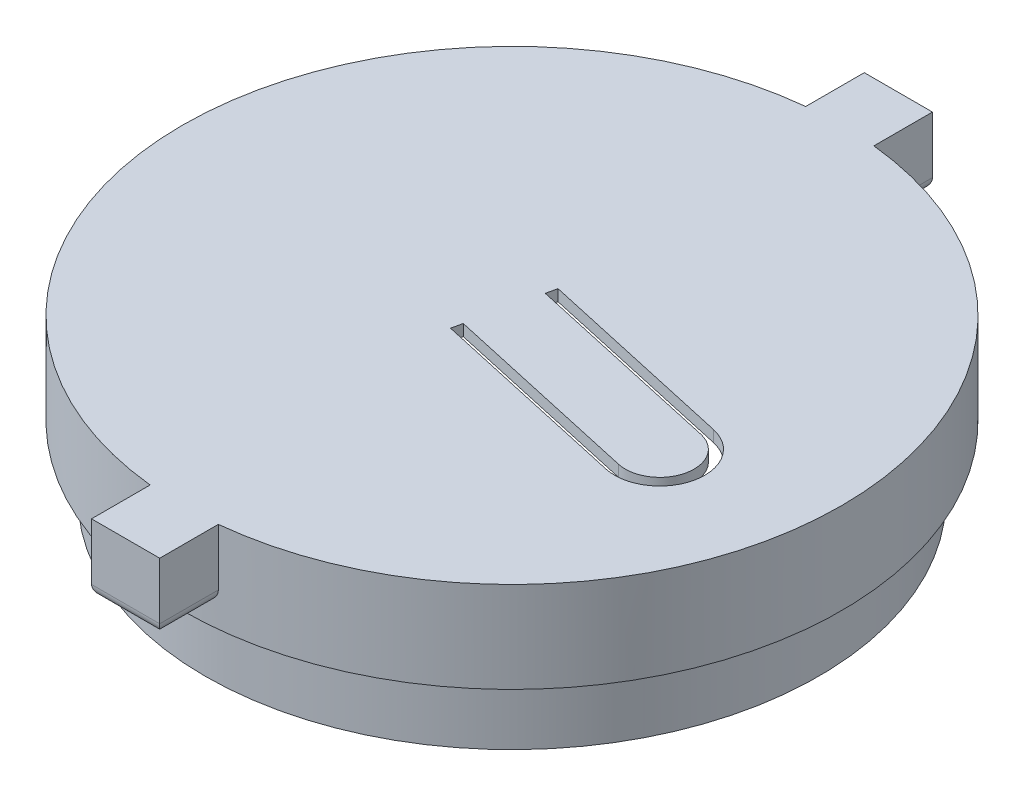
from build123d import *
from build123d.topology import SkipClean

# Parameters (mm, degrees)
SKETCH7_R            = 14.5
SKETCH7_R_2          = 12.5
BOSS_EXTRUDE2_DEPTH  = 4
BOSS_EXTRUDE6_START  = 3.5
SKETCH7_3_R          = 14.5
BOSS_EXTRUDE6_DEPTH  = 0.5
BOSS_EXTRUDE10_START = 4.3
BOSS_EXTRUDE10_DEPTH = 4.3
BOSS_EXTRUDE9_START  = -3
BOSS_EXTRUDE9_DEPTH  = 3
FILLET6_R            = 0.5
CUT_EXTRUDE1_DEPTH   = 58.251550322
SKETCH16_R           = 1
BOSS_EXTRUDE11_DEPTH = 1
FILLET7_R            = 0.5
EXTRUDE_THIN2_START  = 3
SKETCH17_R           = 13.5
SKETCH17_R_2         = 12.5
EXTRUDE_THIN2_DEPTH  = 3


with BuildPart() as part:
    # Sketch7 → Boss-Extrude2 (new body)
    with BuildSketch(Plane(origin=(0, 0, 0), x_dir=(1, 0, 0), z_dir=(0, 1, 0))):
        with Locations((40, 0)):
            Circle(SKETCH7_R)
        with Locations((40, 0)):
            Circle(SKETCH7_R_2, mode=Mode.SUBTRACT)
    extrude(amount=BOSS_EXTRUDE2_DEPTH)

    # Sketch7<3> → Boss-Extrude6 (add)
    with BuildSketch(Plane(origin=(0, 0, 0), x_dir=(1, 0, 0), z_dir=(0, 1, 0)).offset(BOSS_EXTRUDE6_START)):
        with Locations((40, 0)):
            Circle(SKETCH7_3_R)
    extrude(amount=BOSS_EXTRUDE6_DEPTH)

    # Sketch14 → Boss-Extrude10 (add)
    with BuildSketch(Plane.XZ.offset(-3.5).offset(BOSS_EXTRUDE10_START)):
        with BuildLine():
            Line((48.005623024, -9.6), (31.994376976, -9.6))
            ThreePointArc((31.994376976, -9.6), (40, -12.5), (48.005623024, -9.6))
        make_face()
        with BuildLine():
            Line((50.85, -6.207052441), (50.85, 6.207052441))
            ThreePointArc((50.85, 6.207052441), (52.5, 0), (50.85, -6.207052441))
        make_face()
        with BuildLine():
            Line((48.005623024, 9.6), (31.994376976, 9.6))
            ThreePointArc((31.994376976, 9.6), (40, 12.5), (48.005623024, 9.6))
        make_face()
        with BuildLine():
            Line((29.15, -6.207052441), (29.15, 6.207052441))
            ThreePointArc((29.15, 6.207052441), (27.5, 0), (29.15, -6.207052441))
        make_face()
    extrude(amount=-BOSS_EXTRUDE10_DEPTH)

    # Sketch11 → Boss-Extrude9 (add)
    with BuildSketch(Plane(origin=(0, 4, 0), x_dir=(1, 0, 0), z_dir=(0, 1, 0)).offset(BOSS_EXTRUDE9_START)):
        with BuildLine():
            Line((41.5, 17), (38.5, 17))
            Line((38.5, 17), (38.5, 14.422205102))
            ThreePointArc((38.5, 14.422205102), (40, 14.5), (41.5, 14.422205102))
            Line((41.5, 14.422205102), (41.5, 17))
        make_face()
        with BuildLine():
            ThreePointArc((41.5, -14.422205102), (40, -14.5), (38.5, -14.422205102))
            Line((38.5, -14.422205102), (38.5, -17))
            Line((38.5, -17), (41.5, -17))
            Line((41.5, -17), (41.5, -14.422205102))
        make_face()
    extrude(amount=BOSS_EXTRUDE9_DEPTH)

    # Fillet6
    fillet6_edges = [part.edges().sort_by_distance(p)[0] for p in [
        (41.5, 1, 15.711102551),
        (38.5, 1, 15.711102551),
        (38.5, 1, -15.711102551),
        (41.5, 1, -15.711102551),
        (40, 1, -17),
        (40, 1, 17),
    ]]
    fillet(fillet6_edges, radius=FILLET6_R)

    # Sketch15 → Cut-Extrude1 (cut, through all)
    with BuildSketch(Plane(origin=(0, 3.5, 0), x_dir=(-1, 0, 0), z_dir=(0, -1, 0))):
        with BuildLine():
            Line((-39.992028986, 2.032868758), (-48.778948791, 0.086066167))
            ThreePointArc((-48.778948791, 0.086066167), (-50.286066167, -2.278948791), (-47.921051209, -3.786066167))
            Line((-47.921051209, -3.786066167), (-39.134131403, -1.839263575))
            Line((-39.134131403, -1.839263575), (-39.235771296, -1.380510545))
            Line((-39.235771296, -1.380510545), (-48.022691101, -3.327313137))
            ThreePointArc((-48.022691101, -3.327313137), (-49.827313137, -2.177308899), (-48.677308899, -0.372686863))
            Line((-48.677308899, -0.372686863), (-39.890389093, 1.574115728))
            Line((-39.890389093, 1.574115728), (-39.992028986, 2.032868758))
        make_face()
    extrude(amount=-CUT_EXTRUDE1_DEPTH, mode=Mode.SUBTRACT)

    # Sketch16 → Boss-Extrude11 (add)
    with BuildSketch(Plane(origin=(0, 3.5, 0), x_dir=(-1, 0, 0), z_dir=(0, -1, 0))):
        with Locations((-48.35, -1.85)):
            Circle(SKETCH16_R)
    extrude(amount=BOSS_EXTRUDE11_DEPTH)

    # Fillet7
    fillet7_edges = [part.edges().sort_by_distance(p)[0] for p in [
        (49.35, 3.5, 1.85),
    ]]
    fillet(fillet7_edges, radius=FILLET7_R)

    # Sketch17 → Extrude-Thin2 (add)
    with SkipClean():  # the faces are left unmerged after this step: merging them gives an invalid solid
        with BuildSketch(Plane(origin=(0, 0, 0), x_dir=(-1, 0, 0), z_dir=(0, -1, 0)).offset(EXTRUDE_THIN2_START)):
            with Locations((-40, 0)):
                Circle(SKETCH17_R)
            with Locations((-40, 0)):
                Circle(SKETCH17_R_2, mode=Mode.SUBTRACT)
        extrude(amount=-EXTRUDE_THIN2_DEPTH)
    add(part.part.scale(1), mode=Mode.REPLACE)  # the faces are merged on a copy


solid = part.part
